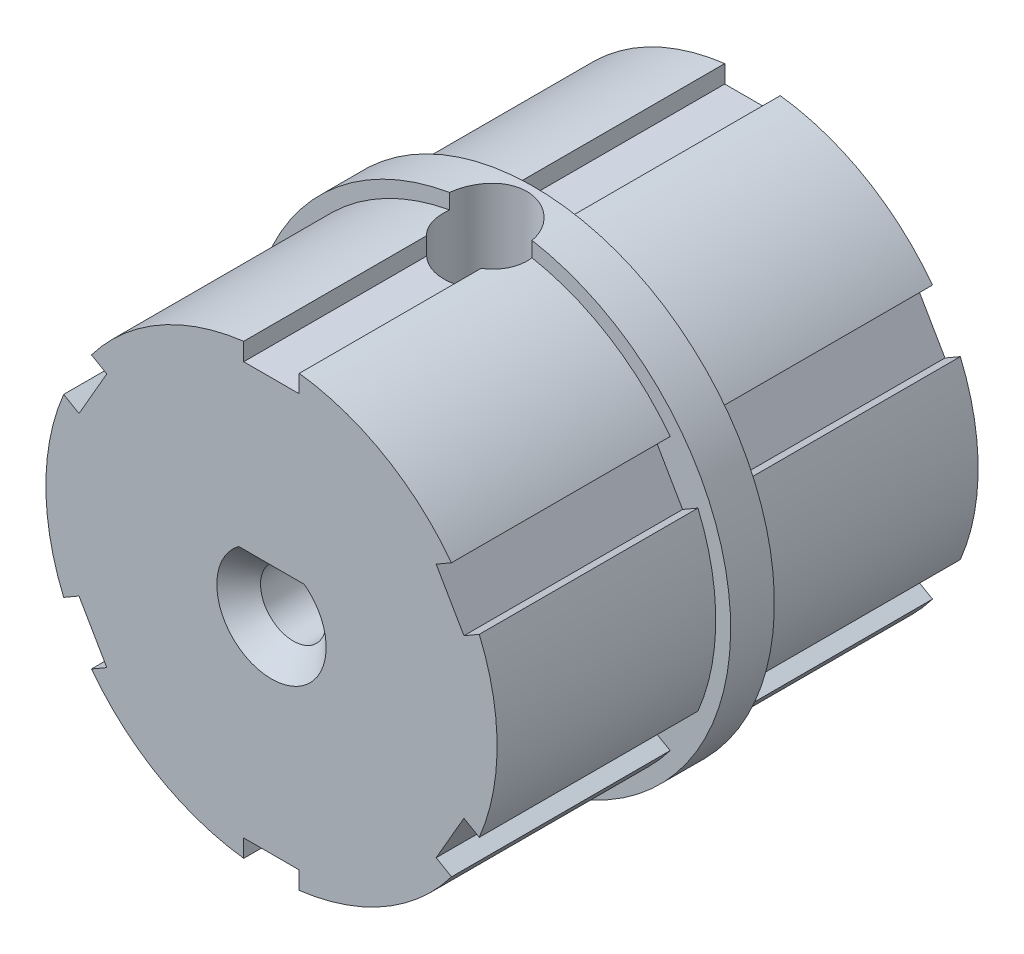
from build123d import *

# Parameters (mm, degrees)
EXTRUDE_1_DEPTH          = 22
SKETCH_2_R               = 7.5
CUT_EXTRUDE_1_DEPTH      = 9
CUT_EXTRUDE_3_DEPTH      = 1
CUT_EXTRUDE_3_DEPTH_BACK = 8.42975
SKETCH_4_R               = 1.9
CHAMFER_1_SIZE           = 1
EXTRUDE_START            = -10
SKETCH_5_R               = 11
SKETCH_5_R_2             = 9.429749991
EXTRUDE_2_DEPTH          = 2
CUT_EXTRUDE_4_DEPTH      = 2
CUT_EXTRUDE_4_DEPTH_BACK = 2
SKETCH_6_R               = 1.9


with BuildPart() as part:
    # Эскиз1 → Бобышка-Вытянуть1 (new body)
    with BuildSketch(Plane.XY):
        with BuildLine():
            Line((13.201310027, -7.85542296), (13.90326512, -8.260696921))
            ThreePointArc((13.90326512, -8.260696921), (14.718656981, -4.240400213), (13.903265122, -0.220103504))
            Line((13.903265122, -0.220103504), (13.201310027, -0.625377467))
            Line((13.201310027, -0.625377467), (11.931310033, 1.574327047))
            Line((11.931310033, 1.574327047), (12.633265127, 1.979601009))
            ThreePointArc((12.633265127, 1.979601009), (9.559281984, 4.695899416), (5.669906988, 5.999897702))
            Line((5.669906988, 5.999897702), (5.669906988, 5.189349779))
            Line((5.669906988, 5.189349779), (3.129906988, 5.189349779))
            Line((3.129906988, 5.189349779), (3.129906988, 5.999897708))
            ThreePointArc((3.129906988, 5.999897708), (-0.759468012, 4.69589942), (-3.833451156, 1.979601011))
            Line((-3.833451156, 1.979601011), (-3.131496059, 1.574327046))
            Line((-3.131496059, 1.574327046), (-4.401496055, -0.625377472))
            Line((-4.401496055, -0.625377472), (-5.103451147, -0.22010351))
            ThreePointArc((-5.103451147, -0.22010351), (-5.918843009, -4.240400218), (-5.10345115, -8.260696926))
            Line((-5.10345115, -8.260696926), (-4.401496056, -7.855422963))
            Line((-4.401496056, -7.855422963), (-3.13149606, -10.055127481))
            Line((-3.13149606, -10.055127481), (-3.833451154, -10.460401444))
            ThreePointArc((-3.833451154, -10.460401444), (-0.759468012, -13.17669985), (3.129906983, -14.480698136))
            Line((3.129906983, -14.480698136), (3.129906983, -13.670150213))
            Line((3.129906983, -13.670150213), (5.669906983, -13.670150213))
            Line((5.669906983, -13.670150213), (5.669906983, -14.480698142))
            ThreePointArc((5.669906983, -14.480698142), (9.559281984, -13.176699854), (12.633265129, -10.460401443))
            Line((12.633265129, -10.460401443), (11.931310031, -10.055127478))
            Line((11.931310031, -10.055127478), (13.201310027, -7.85542296))
        make_face()
        with BuildLine():
            Line((3.281873001, -3.240400222), (5.517940979, -3.240400222))
            ThreePointArc((5.517940979, -3.240400222), (4.39990699, -5.740400222), (3.281873001, -3.240400222))
        make_face(mode=Mode.SUBTRACT)
    extrude(amount=EXTRUDE_1_DEPTH)

    # Эскиз2 → Вырез-Вытянуть1 (cut)
    with BuildSketch(Plane(origin=(0, 0, 0), x_dir=(-1, 0, 0), z_dir=(0, 0, -1))):
        with Locations((-4.39990699, -4.240400222)):
            Circle(SKETCH_2_R)
    extrude(amount=-CUT_EXTRUDE_1_DEPTH, mode=Mode.SUBTRACT)

    # Эскиз4 → Вырез-Вытянуть3 (cut, two sides: drawn at the far end of the back side and taken through both)
    with BuildSketch(Plane(origin=(0, 5.189349779, 0), x_dir=(1, 0, 0), z_dir=(0, 1, 0)).offset(-CUT_EXTRUDE_3_DEPTH_BACK)):
        with Locations(Location((4.428692677, -12.248697559, 0), (0, 0, 55.020131728))):
            Circle(SKETCH_4_R)
    extrude(amount=CUT_EXTRUDE_3_DEPTH + CUT_EXTRUDE_3_DEPTH_BACK, mode=Mode.SUBTRACT)

    # Фаска1
    chamfer_1_edges = [part.edges().sort_by_distance(p)[0] for p in [
        (4.39990699, -5.740400222, 22),
        (4.39990699, -3.240400222, 22),
        (4.39990699, -3.240400222, 9),
        (4.39990699, -5.740400222, 9),
    ]]
    chamfer(chamfer_1_edges, length=CHAMFER_1_SIZE)

    # Эскиз5 → Бобышка-Вытянуть2 (add)
    with BuildSketch(Plane(origin=(0, 0, 0), x_dir=(-1, 0, 0), z_dir=(0, 0, -1)).offset(EXTRUDE_START)):
        with Locations((-4.39990699, -4.240400222)):
            Circle(SKETCH_5_R)
        with Locations((-4.39990699, -4.240400222)):
            Circle(SKETCH_5_R_2, mode=Mode.SUBTRACT)
    extrude(amount=-EXTRUDE_2_DEPTH)

    # Эскиз6 → Вырез-Вытянуть4 (cut, two sides: drawn at the far end of the back side and taken through both)
    with BuildSketch(Plane(origin=(0, 5.189349779, 0), x_dir=(1, 0, 0), z_dir=(0, 1, 0)).offset(-CUT_EXTRUDE_4_DEPTH_BACK)):
        with Locations(Location((4.428692677, -12.248697559, 0), (0, 0, 55.020131728))):
            Circle(SKETCH_6_R)
    extrude(amount=CUT_EXTRUDE_4_DEPTH + CUT_EXTRUDE_4_DEPTH_BACK, mode=Mode.SUBTRACT)


solid = part.part
